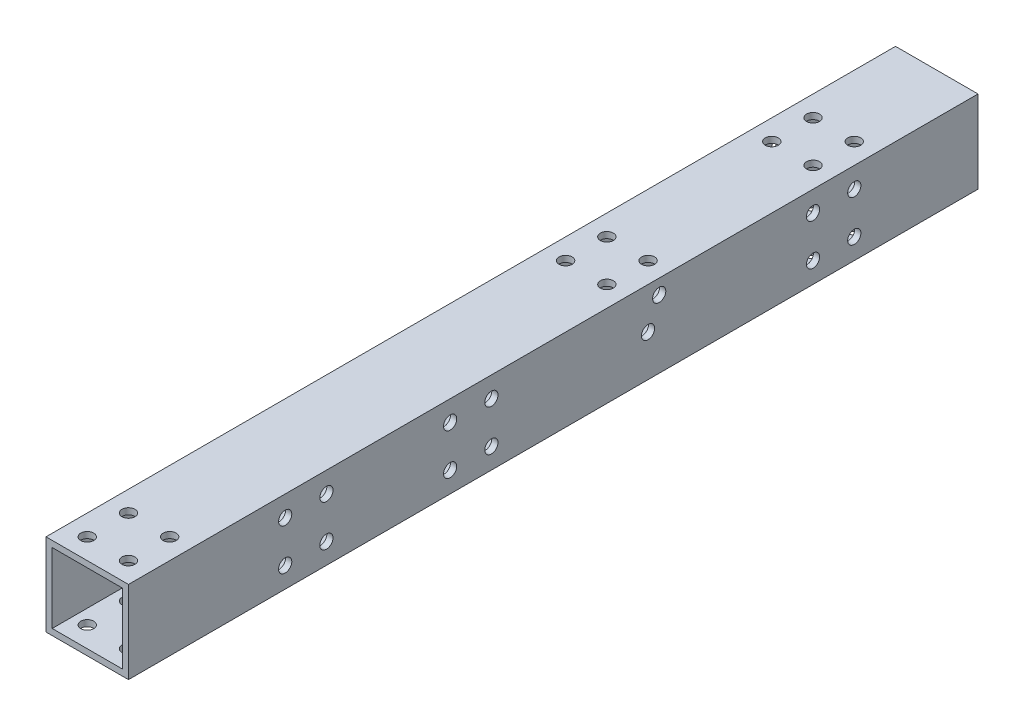
from build123d import *

# Parameters (mm, degrees)
SKETCH_1_W          = 20
SKETCH_1_H          = 20
SKETCH_1_W_2        = 17
SKETCH_1_H_2        = 17
EXTRUDE_1_DEPTH     = 206
SKETCH_2_R          = 1.575
CUT_EXTRUDE_1_DEPTH = 208.932681414
SKETCH_3_R          = 1.6
CUT_EXTRUDE_2_DEPTH = 208.932681414


with BuildPart() as part:
    # 草图1 → 拉伸-薄壁1 (new body)
    with BuildSketch(Plane.XY):
        with Locations((10, -10)):
            Rectangle(SKETCH_1_W, SKETCH_1_H)
        with Locations((10, -10)):
            Rectangle(SKETCH_1_W_2, SKETCH_1_H_2, mode=Mode.SUBTRACT)
    extrude(amount=EXTRUDE_1_DEPTH)

    # 草图2 → 切除-拉伸1 (cut, through all)
    with BuildSketch(Plane(origin=(0, 0, 0), x_dir=(1, 0, 0), z_dir=(0, 1, 0))):
        with Locations(Location((5, -191, 0), (0, 0, 270))):
            Circle(SKETCH_2_R)
        with Locations(Location((15, -191, 0), (0, 0, 90))):
            Circle(SKETCH_2_R)
        with Locations(Location((15, -201, 0), (0, 0, 270))):
            Circle(SKETCH_2_R)
        with Locations(Location((5, -201, 0), (0, 0, 90))):
            Circle(SKETCH_2_R)
        with Locations(Location((5, -25, 0), (0, 0, 270))):
            Circle(SKETCH_2_R)
        with Locations(Location((15, -25, 0), (0, 0, 90))):
            Circle(SKETCH_2_R)
        with Locations(Location((15, -35, 0), (0, 0, 270))):
            Circle(SKETCH_2_R)
        with Locations(Location((5, -35, 0), (0, 0, 90))):
            Circle(SKETCH_2_R)
        with Locations(Location((5, -75, 0), (0, 0, 270))):
            Circle(SKETCH_2_R)
        with Locations(Location((15, -75, 0), (0, 0, 90))):
            Circle(SKETCH_2_R)
        with Locations(Location((15, -85, 0), (0, 0, 270))):
            Circle(SKETCH_2_R)
        with Locations(Location((5, -85, 0), (0, 0, 90))):
            Circle(SKETCH_2_R)
    extrude(amount=-CUT_EXTRUDE_1_DEPTH, mode=Mode.SUBTRACT)

    # 草图3 → 切除-拉伸2 (cut, through all)
    with BuildSketch(Plane.ZY):
        with Locations(Location((118, -5, 0), (0, 0, 270))):
            Circle(SKETCH_3_R)
        with Locations((128, -5)):
            Circle(SKETCH_3_R)
        with Locations(Location((128, -15, 0), (0, 0, 270))):
            Circle(SKETCH_3_R)
        with Locations((118, -15)):
            Circle(SKETCH_3_R)
        with Locations(Location((168, -15, 0), (0, 0, 270))):
            Circle(SKETCH_3_R)
        with Locations((158, -15)):
            Circle(SKETCH_3_R)
        with Locations(Location((158, -5, 0), (0, 0, 270))):
            Circle(SKETCH_3_R)
        with Locations((168, -5)):
            Circle(SKETCH_3_R)
        with Locations(Location((30, -5, 0), (0, 0, 270))):
            Circle(SKETCH_3_R)
        with Locations((40, -5)):
            Circle(SKETCH_3_R)
        with Locations(Location((40, -15, 0), (0, 0, 270))):
            Circle(SKETCH_3_R)
        with Locations((30, -15)):
            Circle(SKETCH_3_R)
        with Locations(Location((80, -10, 0), (0, 0, 270))):
            Circle(SKETCH_3_R)
        with Locations(Location((77.307692308, -3.538461538, 0), (0, 0, 270))):
            Circle(SKETCH_3_R)
    extrude(amount=-CUT_EXTRUDE_2_DEPTH, mode=Mode.SUBTRACT)


solid = part.part
